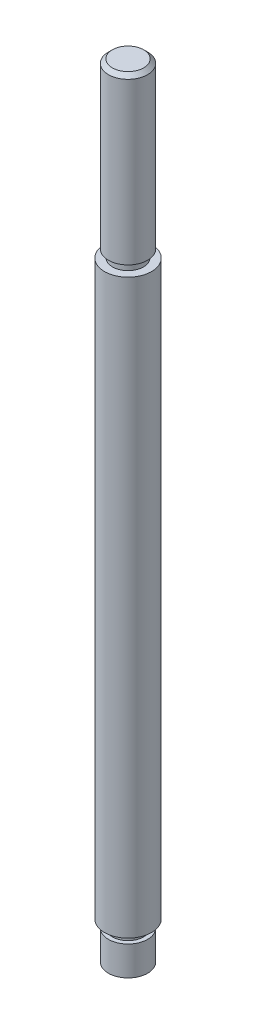
from build123d import *

# Parameters (mm, degrees)
CHAMFER1_SIZE = 1


with BuildPart() as part:
    # Sketch1 → Revolve1 (revolve)
    with BuildSketch(Plane.XY, mode=Mode.PRIVATE) as revolve1_sk:
        Polygon((0, 0), (5, 0), (5, 7.5), (3.95, 7.5), (3.95, 9.5), (6, 9.5), (6, 155.5), (3.95, 155.5), (3.95, 157.5), (5, 157.5), (5, 199.5), (0, 199.5), align=None)
    revolve(revolve1_sk.sketch.rotate(Axis((0, 0, 0), (0, 1, 0)), 90), axis=Axis((0, 0, 0), (0, 1, 0)))

    # Chamfer1
    chamfer1_edges = [part.edges().sort_by_distance(p)[0] for p in [
        (0, 199.5, 5),
    ]]
    chamfer(chamfer1_edges, length=CHAMFER1_SIZE)


solid = part.part
